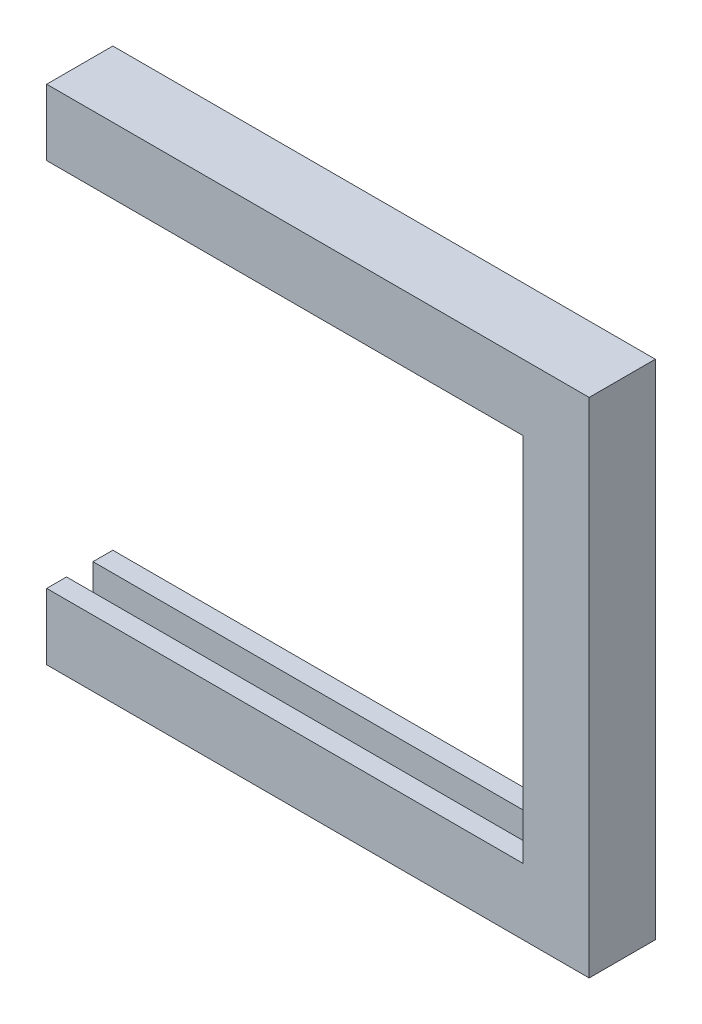
from build123d import *

# Parameters (mm, degrees)
ESQUISSE1_W             = 41
ESQUISSE1_H             = 38
BOSS_EXTRU_1_DEPTH      = 5
ESQUISSE6_W             = 36
ESQUISSE6_H             = 21
ENL_V_MAT_EXTRU_3_DEPTH = 5
ESQUISSE7_W             = 2
ESQUISSE7_H             = 32
ENL_V_MAT_EXTRU_4_DEPTH = 36
ESQUISSE8_W             = 5
ESQUISSE8_H             = 28
ENL_V_MAT_EXTRU_5_DEPTH = 36


with BuildPart() as part:
    # Esquisse1 → Boss.-Extru.1 (new body)
    with BuildSketch(Plane.XY):
        with Locations((20.5, 19)):
            Rectangle(ESQUISSE1_W, ESQUISSE1_H)
    extrude(amount=BOSS_EXTRU_1_DEPTH)

    # Esquisse6 → Enlèv. mat.-Extru.3 (cut)
    with BuildSketch(Plane(origin=(0, 0, 0), x_dir=(-1, 0, 0), z_dir=(0, 0, -1))):
        with Locations((-18, 19)):
            Rectangle(ESQUISSE6_W, ESQUISSE6_H)
    extrude(amount=-ENL_V_MAT_EXTRU_3_DEPTH, mode=Mode.SUBTRACT)

    # Esquisse7 → Enlèv. mat.-Extru.4 (cut)
    with BuildSketch(Plane.ZY):
        with Locations((2.5, 19)):
            Rectangle(ESQUISSE7_W, ESQUISSE7_H)
    extrude(amount=-ENL_V_MAT_EXTRU_4_DEPTH, mode=Mode.SUBTRACT)

    # Esquisse8 → Enlèv. mat.-Extru.5 (cut)
    with BuildSketch(Plane.ZY):
        with Locations((2.5, 19)):
            Rectangle(ESQUISSE8_W, ESQUISSE8_H)
    extrude(amount=-ENL_V_MAT_EXTRU_5_DEPTH, mode=Mode.SUBTRACT)


solid = part.part
